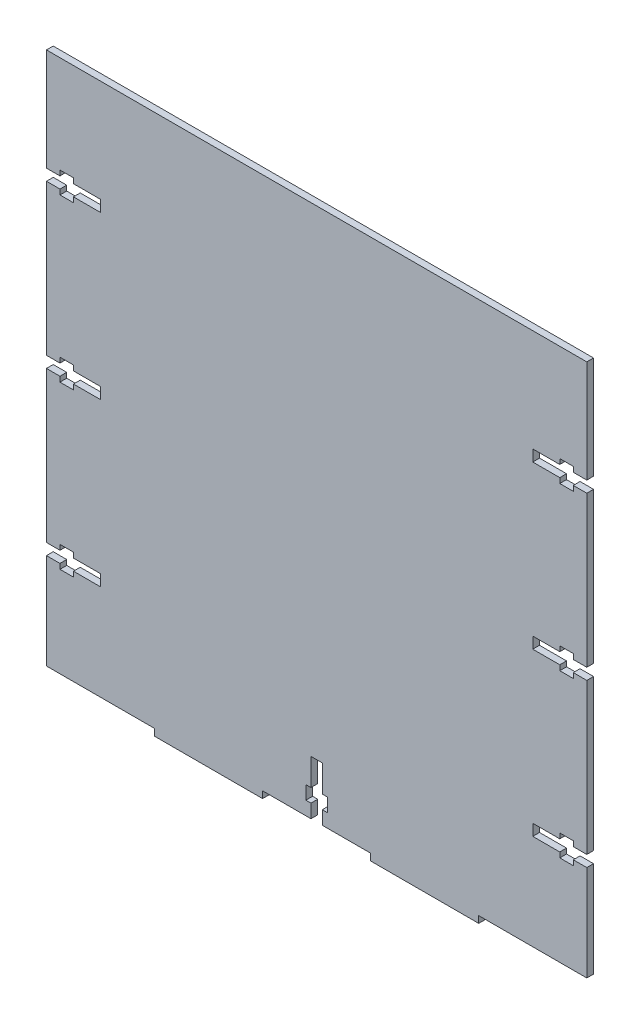
from build123d import *

# Parameters (mm, degrees)
BOSS_EXTRUDE1_DEPTH = 2.5
CUT_EXTRUDE1_DEPTH  = 2.5


with BuildPart() as part:
    # Sketch1 → Boss-Extrude1 (new body)
    with BuildSketch(Plane.XY):
        Polygon((-60, -100), (-20, -100), (-20, -97.5), (-2.1, -97.5), (-2.1, -92.5), (-4, -92.5), (-4, -87.5), (-2.1, -87.5), (-2.1, -77.5), (0, -77.5), (2.1, -77.5), (2.1, -87.5), (4, -87.5), (4, -92.5), (2.1, -92.5), (2.1, -97.5), (20, -97.5), (20, -100), (60, -100), (60, -97.5), (100, -97.5), (100, 100), (-100, 100), (-100, -97.5), (-60, -97.5), align=None)
    extrude(amount=BOSS_EXTRUDE1_DEPTH)

    # Sketch4 → Cut-Extrude1 (cut)
    with BuildSketch(Plane(origin=(0, 0, 0), x_dir=(-1, 0, 0), z_dir=(0, 0, -1))):
        Polygon((-80, 0), (-100, 0), (-100, -2.1), (-95, -2.1), (-95, -4), (-90, -4), (-90, -2.1), (-80, -2.1), align=None)
        Polygon((-95, 2.1), (-100, 2.1), (-100, 0), (-80, 0), (-80, 2.1), (-90, 2.1), (-90, 4), (-95, 4), align=None)
        Polygon((-95, 62.1), (-100, 62.1), (-100, 57.9), (-95, 57.9), (-95, 56), (-90, 56), (-90, 57.9), (-80, 57.9), (-80, 62.1), (-90, 62.1), (-90, 64), (-95, 64), align=None)
        Polygon((-95, -57.9), (-100, -57.9), (-100, -62.1), (-95, -62.1), (-95, -64), (-90, -64), (-90, -62.1), (-80, -62.1), (-80, -57.9), (-90, -57.9), (-90, -56), (-95, -56), align=None)
        Polygon((95, 57.9), (100, 57.9), (100, 62.1), (95, 62.1), (95, 64), (90, 64), (90, 62.1), (80, 62.1), (80, 57.9), (90, 57.9), (90, 56), (95, 56), align=None)
        Polygon((95, -2.1), (100, -2.1), (100, 2.1), (95, 2.1), (95, 4), (90, 4), (90, 2.1), (80, 2.1), (80, -2.1), (90, -2.1), (90, -4), (95, -4), align=None)
        Polygon((100, -62.1), (100, -57.9), (95, -57.9), (95, -56), (90, -56), (90, -57.9), (80, -57.9), (80, -62.1), (90, -62.1), (90, -64), (95, -64), (95, -62.1), align=None)
    extrude(amount=-CUT_EXTRUDE1_DEPTH, mode=Mode.SUBTRACT)


solid = part.part
